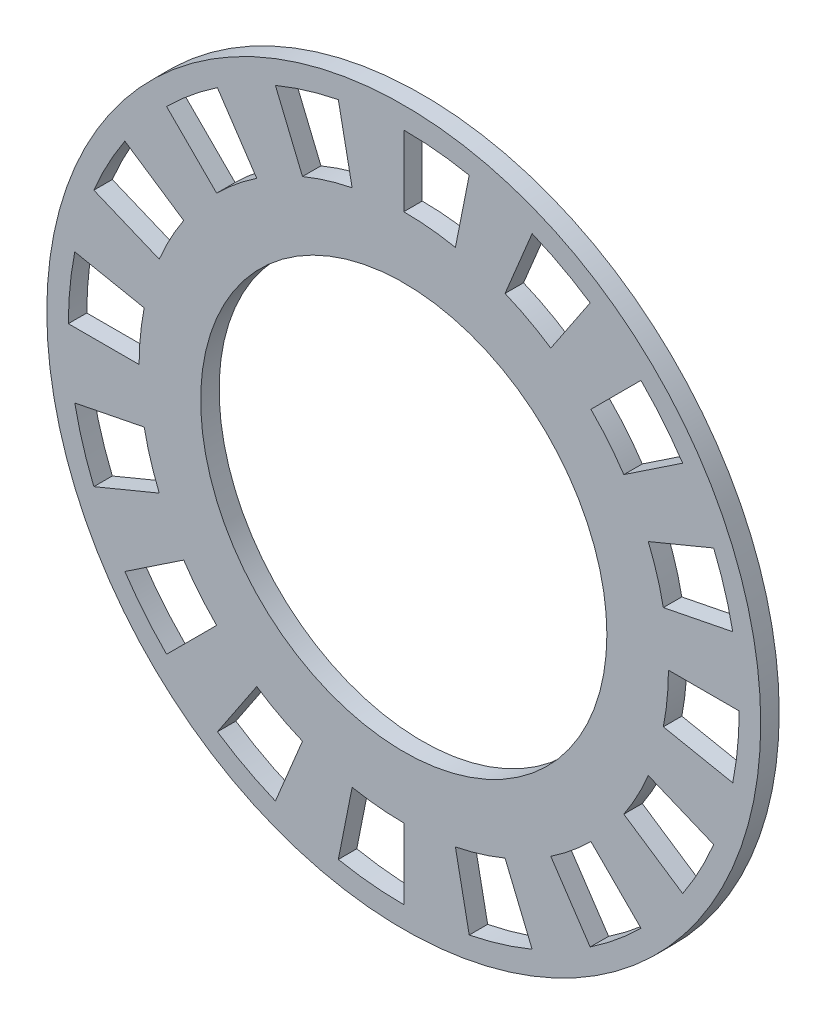
from build123d import *

# Parameters (mm, degrees)
MODEL_R                 = 29
MODEL_R_2               = 16.5
SALIENTE_EXTRUIR1_DEPTH = 1.5


with BuildPart() as part:
    # Model → Saliente-Extruir1 (new body)
    with BuildSketch(Plane.XY):
        with Locations((38.490393449, 265.517783021)):
            Circle(MODEL_R)
        with Locations((38.490393449, 265.517783021)):
            Circle(MODEL_R_2, mode=Mode.SUBTRACT)
        with BuildLine():
            Line((38.490393449, 287.017783021), (38.490393449, 292.767783021))
            ThreePointArc((38.490393449, 292.767783021), (41.161360523, 292.636566823), (43.806604724, 292.244181912))
            Line((43.806604724, 292.244181912), (42.684835372, 286.60466655))
            ThreePointArc((42.684835372, 286.60466655), (40.597761966, 286.914254645), (38.490393449, 287.017783021))
        make_face(mode=Mode.SUBTRACT)
        with BuildLine():
            Line((34.295951526, 286.60466655), (33.174182174, 292.244181912))
            ThreePointArc((33.174182174, 292.244181912), (30.580135994, 291.59440717), (28.062269917, 290.693500282))
            Line((28.062269917, 290.693500282), (30.262699653, 285.38119297))
            ThreePointArc((30.262699653, 285.38119297), (32.249272888, 286.09200024), (34.295951526, 286.60466655))
        make_face(mode=Mode.SUBTRACT)
        with BuildLine():
            Line((26.545633439, 283.394379686), (23.351104599, 288.175329957))
            ThreePointArc((23.351104599, 288.175329957), (21.203176455, 286.582317876), (19.221733662, 284.786442809))
            Line((19.221733662, 284.786442809), (23.287597653, 280.720578817))
            ThreePointArc((23.287597653, 280.720578817), (24.850937839, 282.137507769), (26.545633439, 283.394379686))
        make_face(mode=Mode.SUBTRACT)
        with BuildLine():
            Line((20.613796784, 277.462543031), (15.832846514, 280.657071871))
            ThreePointArc((15.832846514, 280.657071871), (14.458038995, 278.3633441), (13.314676188, 275.945906553))
            Line((13.314676188, 275.945906553), (18.6269835, 273.745476817))
            ThreePointArc((18.6269835, 273.745476817), (19.529086265, 275.652812863), (20.613796784, 277.462543031))
        make_face(mode=Mode.SUBTRACT)
        with BuildLine():
            Line((17.40350992, 269.712224945), (11.763994558, 270.833994296))
            ThreePointArc((11.763994558, 270.833994296), (11.371609647, 268.188750095), (11.240393449, 265.517783021))
            Line((11.240393449, 265.517783021), (16.990393449, 265.517783021))
            ThreePointArc((16.990393449, 265.517783021), (17.093921825, 267.625151538), (17.40350992, 269.712224945))
        make_face(mode=Mode.SUBTRACT)
        with BuildLine():
            Line((17.40350992, 261.323341098), (11.763994558, 260.201571746))
            ThreePointArc((11.763994558, 260.201571746), (12.4137693, 257.607525566), (13.314676188, 255.089659489))
            Line((13.314676188, 255.089659489), (18.6269835, 257.290089226))
            ThreePointArc((18.6269835, 257.290089226), (17.916176231, 259.27666246), (17.40350992, 261.323341098))
        make_face(mode=Mode.SUBTRACT)
        with BuildLine():
            Line((20.613796784, 253.573023011), (15.832846514, 250.378494172))
            ThreePointArc((15.832846514, 250.378494172), (17.425858595, 248.230566028), (19.221733662, 246.249123234))
            Line((19.221733662, 246.249123234), (23.287597653, 250.314987226))
            ThreePointArc((23.287597653, 250.314987226), (21.870668702, 251.878327412), (20.613796784, 253.573023011))
        make_face(mode=Mode.SUBTRACT)
        with BuildLine():
            Line((26.545633439, 247.641186357), (23.351104599, 242.860236086))
            ThreePointArc((23.351104599, 242.860236086), (25.64483237, 241.485428568), (28.062269917, 240.34206576))
            Line((28.062269917, 240.34206576), (30.262699653, 245.654373072))
            ThreePointArc((30.262699653, 245.654373072), (28.355363607, 246.556475838), (26.545633439, 247.641186357))
        make_face(mode=Mode.SUBTRACT)
        with BuildLine():
            Line((34.295951526, 244.430899493), (33.174182174, 238.79138413))
            ThreePointArc((33.174182174, 238.79138413), (35.819426375, 238.39899922), (38.490393449, 238.267783021))
            Line((38.490393449, 238.267783021), (38.490393449, 244.017783021))
            ThreePointArc((38.490393449, 244.017783021), (36.383024932, 244.121311398), (34.295951526, 244.430899493))
        make_face(mode=Mode.SUBTRACT)
        with BuildLine():
            Line((42.684835372, 244.430899493), (43.806604724, 238.79138413))
            ThreePointArc((43.806604724, 238.79138413), (46.400650904, 239.441158873), (48.918516981, 240.34206576))
            Line((48.918516981, 240.34206576), (46.718087245, 245.654373072))
            ThreePointArc((46.718087245, 245.654373072), (44.73151401, 244.943565803), (42.684835372, 244.430899493))
        make_face(mode=Mode.SUBTRACT)
        with BuildLine():
            Line((50.435153459, 247.641186357), (53.629682299, 242.860236086))
            ThreePointArc((53.629682299, 242.860236086), (55.777610442, 244.453248167), (57.759053236, 246.249123234))
            Line((57.759053236, 246.249123234), (53.693189244, 250.314987226))
            ThreePointArc((53.693189244, 250.314987226), (52.129849058, 248.898058274), (50.435153459, 247.641186357))
        make_face(mode=Mode.SUBTRACT)
        with BuildLine():
            Line((56.366990113, 253.573023011), (61.147940384, 250.378494172))
            ThreePointArc((61.147940384, 250.378494172), (62.522747902, 252.672221943), (63.66611071, 255.089659489))
            Line((63.66611071, 255.089659489), (58.353803398, 257.290089226))
            ThreePointArc((58.353803398, 257.290089226), (57.451700632, 255.38275318), (56.366990113, 253.573023011))
        make_face(mode=Mode.SUBTRACT)
        with BuildLine():
            Line((59.577276978, 261.323341098), (65.21679234, 260.201571746))
            ThreePointArc((65.21679234, 260.201571746), (65.609177251, 262.846815947), (65.740393449, 265.517783021))
            Line((65.740393449, 265.517783021), (59.990393449, 265.517783021))
            ThreePointArc((59.990393449, 265.517783021), (59.886865072, 263.410414504), (59.577276978, 261.323341098))
        make_face(mode=Mode.SUBTRACT)
        with BuildLine():
            Line((59.577276978, 269.712224945), (65.21679234, 270.833994296))
            ThreePointArc((65.21679234, 270.833994296), (64.567017598, 273.428040477), (63.66611071, 275.945906553))
            Line((63.66611071, 275.945906553), (58.353803398, 273.745476817))
            ThreePointArc((58.353803398, 273.745476817), (59.064610667, 271.758903582), (59.577276978, 269.712224945))
        make_face(mode=Mode.SUBTRACT)
        with BuildLine():
            Line((56.366990113, 277.462543031), (61.147940384, 280.657071871))
            ThreePointArc((61.147940384, 280.657071871), (59.554928303, 282.805000015), (57.759053236, 284.786442809))
            Line((57.759053236, 284.786442809), (53.693189244, 280.720578817))
            ThreePointArc((53.693189244, 280.720578817), (55.110118196, 279.157238631), (56.366990113, 277.462543031))
        make_face(mode=Mode.SUBTRACT)
        with BuildLine():
            Line((50.435153459, 283.394379686), (53.629682299, 288.175329957))
            ThreePointArc((53.629682299, 288.175329957), (51.335954527, 289.550137475), (48.918516981, 290.693500282))
            Line((48.918516981, 290.693500282), (46.718087245, 285.38119297))
            ThreePointArc((46.718087245, 285.38119297), (48.625423291, 284.479090205), (50.435153459, 283.394379686))
        make_face(mode=Mode.SUBTRACT)
    extrude(amount=SALIENTE_EXTRUIR1_DEPTH)


solid = part.part
